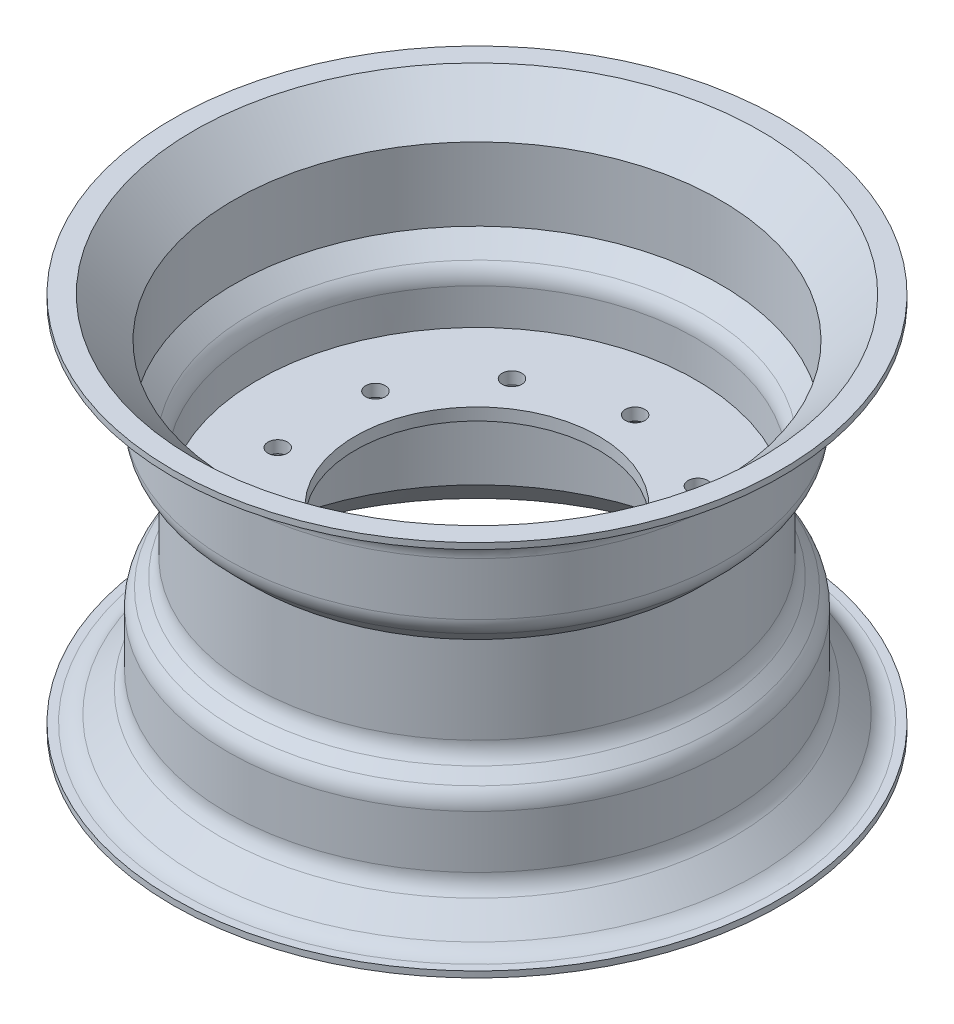
from build123d import *

# Parameters (mm, degrees)
FILLET1_R          = 20
SKETCH2_R          = 8
CUT_EXTRUDE1_DEPTH = 20
CIRPATTERN1_COUNT  = 10


with BuildPart() as part:
    # Sketch1 → Revolve1 (revolve)
    with BuildSketch(Plane.XY, mode=Mode.PRIVATE) as revolve1_sk:
        Polygon((-250, 150), (-235, 150), (-205, 120), (-205, 60), (-185, 40), (-185, -40), (-205, -60), (-205, -120), (-235, -150), (-250, -150), (-250, -155), (-232.928932188, -155), (-200, -122.071067812), (-200, -62.071067812), (-180, -42.071067812), (-180, -5.897680137), (-100, -5.897680137), (-100, 4.102319863), (-180, 4.102319863), (-180, 42.071067812), (-200, 62.071067812), (-200, 122.071067812), (-232.928932188, 155), (-250, 155), align=None)
    revolve(revolve1_sk.sketch.rotate(Axis((0, 200.8318176, 0), (0, -1, 0)), 270), axis=Axis((0, 200.8318176, 0), (0, -1, 0)))

    # Fillet1
    fillet1_edges = [part.edges().sort_by_distance(p)[0] for p in [
        (0, 120, -205),
        (0, 150, -235),
        (0, 42.071067812, -180),
        (0, -150, -235),
        (0, -120, -205),
        (0, -60, -205),
        (0, -40, -185),
        (0, 60, -205),
    ]]
    fillet(fillet1_edges, radius=FILLET1_R)

    # Sketch2 → Cut-Extrude1 (cut)
    with BuildSketch(Plane(origin=(0, 4.102319863, 0), x_dir=(1, 0, 0), z_dir=(0, 1, 0))):
        with Locations(Location((0, 130, 0), (0, 0, 270))):
            Circle(SKETCH2_R)
    cut_extrude1 = extrude(amount=-CUT_EXTRUDE1_DEPTH, mode=Mode.SUBTRACT)

    # CirPattern1: Cut-Extrude1 ×10 about axis
    cirpattern1_axis = Axis((0, 0, 0), (0, 1, 0))
    for i in range(1, CIRPATTERN1_COUNT):
        add(cut_extrude1.rotate(cirpattern1_axis, i * 360 / CIRPATTERN1_COUNT), mode=Mode.SUBTRACT)


solid = part.part
